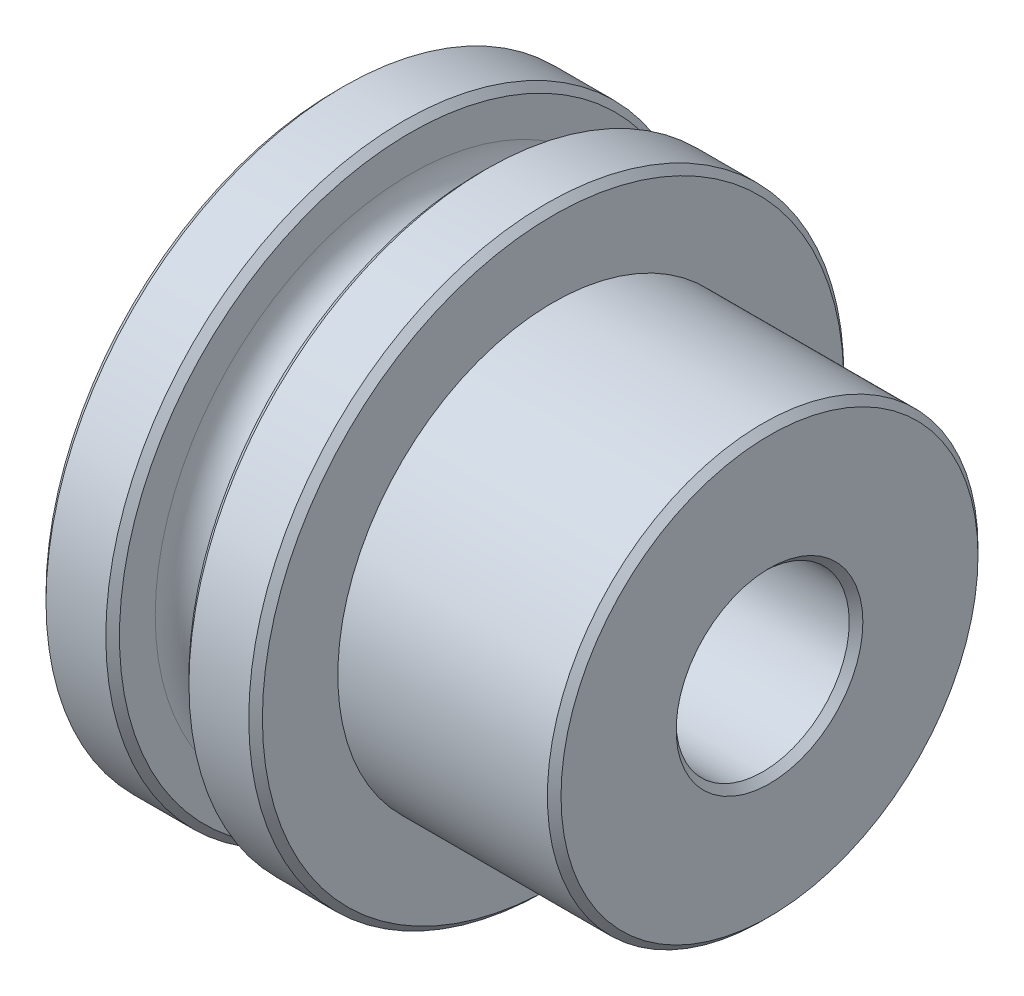
from build123d import *

# Parameters (mm, degrees)
SKETCH1_R           = 12.6365
BOSS_EXTRUDE1_DEPTH = 12.7
SKETCH2_R           = 17.4625
BOSS_EXTRUDE2_DEPTH = 12.7
SKETCH3_R           = 11.1125
CUT_EXTRUDE1_DEPTH  = 7.112
SKETCH4_R           = 7.27458794
CUT_EXTRUDE2_DEPTH  = 0.2
SKETCH5_R           = 5.08
CUT_EXTRUDE3_DEPTH  = 31.611330525
CHAMFER1_SIZE       = 0.4


with BuildPart() as part:
    # Sketch1 → Boss-Extrude1 (new body)
    with BuildSketch(Plane(origin=(0, 0, 0), x_dir=(0, 0, -1), z_dir=(1, 0, 0))):
        Circle(SKETCH1_R)
    extrude(amount=BOSS_EXTRUDE1_DEPTH)

    # Sketch2 → Boss-Extrude2 (add)
    with BuildSketch(Plane.ZY):
        Circle(SKETCH2_R)
    extrude(amount=BOSS_EXTRUDE2_DEPTH)

    # Sketch3 → Cut-Extrude1 (cut)
    with BuildSketch(Plane.ZY.offset(12.7)):
        Circle(SKETCH3_R)
    extrude(amount=-CUT_EXTRUDE1_DEPTH, mode=Mode.SUBTRACT)

    # Sketch4 → Cut-Extrude2 (cut)
    with BuildSketch(Plane.ZY.offset(5.588)):
        Circle(SKETCH4_R)
    extrude(amount=-CUT_EXTRUDE2_DEPTH, mode=Mode.SUBTRACT)

    # Sketch5 → Cut-Extrude3 (cut, through all)
    with BuildSketch(Plane.ZY.offset(5.388)):
        Circle(SKETCH5_R)
    extrude(amount=-CUT_EXTRUDE3_DEPTH, mode=Mode.SUBTRACT)

    # Sketch6 → Cut-Revolve1 (revolve, cut)
    with BuildSketch(Plane.XY, mode=Mode.PRIVATE) as cut_revolve1_sk:
        with BuildLine():
            Line((-8.389999984, 17.4625), (-8.389999984, 14.96249992))
            ThreePointArc((-8.389999984, 14.96249992), (-6.35, 12.922499936), (-4.310000016, 14.96249992))
            Line((-4.310000016, 14.96249992), (-4.310000016, 17.4625))
            Line((-4.310000016, 17.4625), (-8.389999984, 17.4625))
        make_face()
    revolve(cut_revolve1_sk.sketch.rotate(Axis((-6.35, 0, 0), (1, 0, 0)), 90), axis=Axis((-6.35, 0, 0), (1, 0, 0)), mode=Mode.SUBTRACT)

    # Chamfer1
    chamfer1_edges = [part.edges().sort_by_distance(p)[0] for p in [
        (-12.7, 0, -11.1125),
        (12.7, 0, -5.08),
        (-8.389999984, 0, -17.4625),
        (-4.310000016, 0, -17.4625),
        (12.7, 0, 12.6365),
        (0, 0, -17.4625),
        (-12.7, 0, -17.4625),
    ]]
    chamfer(chamfer1_edges, length=CHAMFER1_SIZE)


solid = part.part
